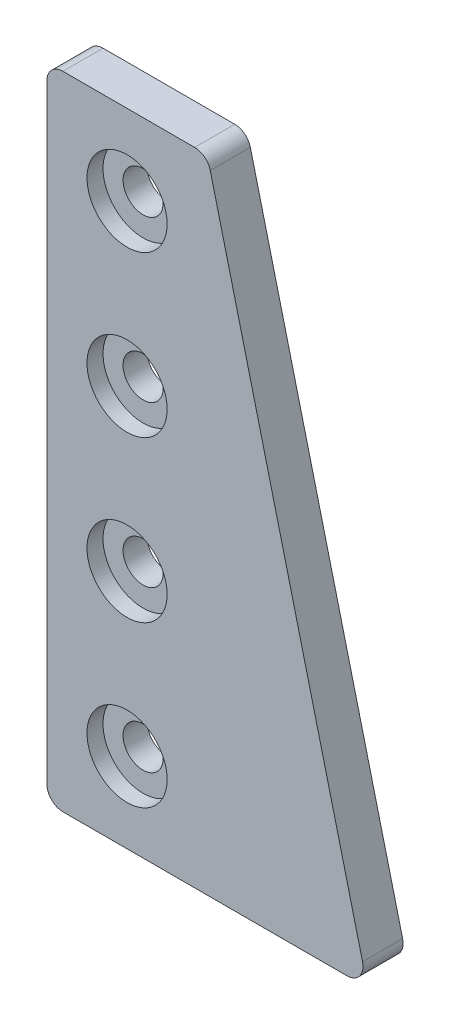
from build123d import *

# Parameters (mm, degrees)
BOSS_EXTRUDE1_DEPTH = 5
SKETCH2_R           = 2.5
CUT_EXTRUDE1_DEPTH  = 10
SKETCH3_R           = 5
CUT_EXTRUDE2_DEPTH  = 2
FILLET1_R           = 2


with BuildPart() as part:
    # Sketch1 → Boss-Extrude1 (new body)
    with BuildSketch(Plane.XY):
        Polygon((0, 0), (0, 80), (20, 80), (40, 0), align=None)
    extrude(amount=BOSS_EXTRUDE1_DEPTH)

    # Sketch2 → Cut-Extrude1 (cut)
    with BuildSketch(Plane.XY.offset(5)):
        with Locations((10, 70)):
            Circle(SKETCH2_R)
        with Locations((10, 50)):
            Circle(SKETCH2_R)
        with Locations((10, 30)):
            Circle(SKETCH2_R)
        with Locations((10, 10)):
            Circle(SKETCH2_R)
    extrude(amount=-CUT_EXTRUDE1_DEPTH, mode=Mode.SUBTRACT)

    # Sketch3 → Cut-Extrude2 (cut)
    with BuildSketch(Plane.XY.offset(5)):
        with Locations((10, 70)):
            Circle(SKETCH3_R)
        with Locations((10, 50)):
            Circle(SKETCH3_R)
        with Locations((10, 30)):
            Circle(SKETCH3_R)
        with Locations((10, 10)):
            Circle(SKETCH3_R)
    extrude(amount=-CUT_EXTRUDE2_DEPTH, mode=Mode.SUBTRACT)

    # Fillet1
    fillet1_edges = [part.edges().sort_by_distance(p)[0] for p in [
        (0, 0, 2.5),
        (0, 80, 2.5),
        (20, 80, 2.5),
        (40, 0, 2.5),
    ]]
    fillet(fillet1_edges, radius=FILLET1_R)


solid = part.part
